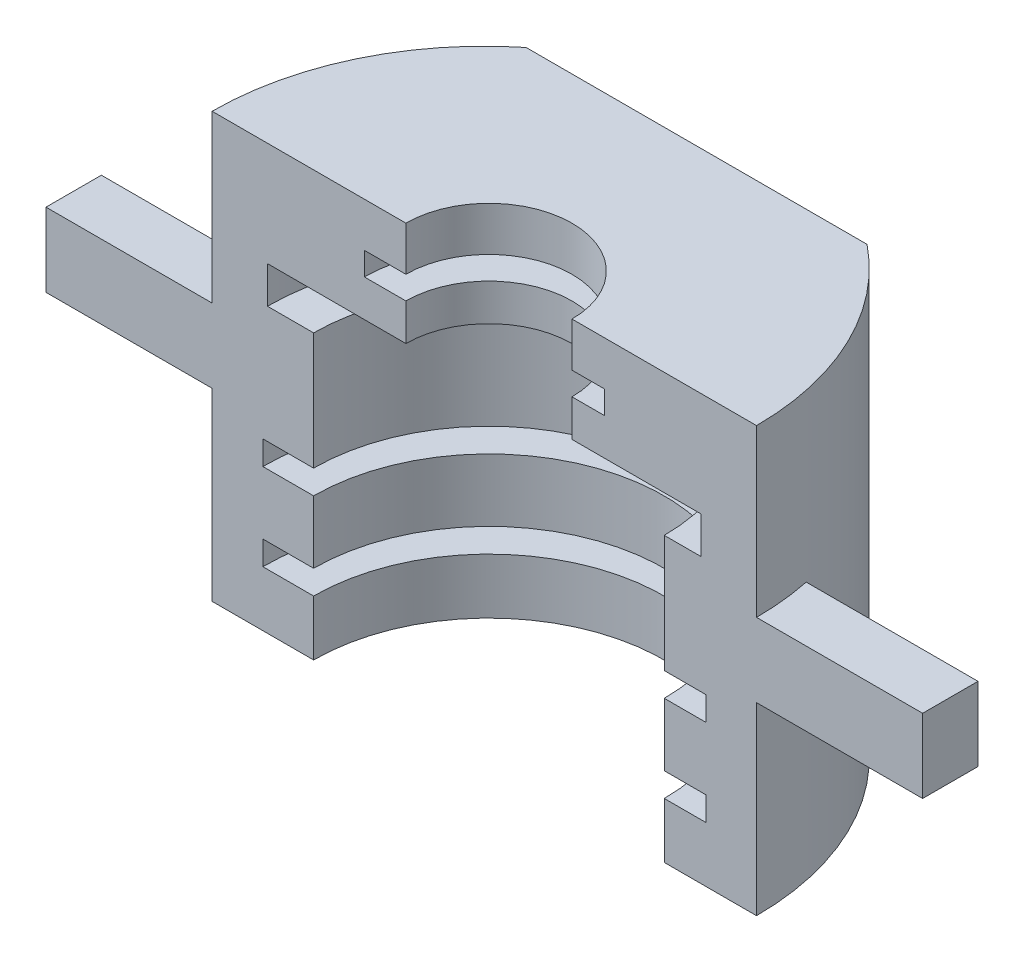
from build123d import *

# Parameters (mm, degrees)
REVOLUCI_N1_ANGLE       = 180
CORTAR_EXTRUIR1_DEPTH   = 17
CORTAR_EXTRUIR2_START   = -5.65
CORTAR_EXTRUIR2_DEPTH   = 5.65
CORTAR_EXTRUIR3_START   = -23
CROQUIS4_W              = 20.036929734
CROQUIS4_H              = 3.3102989
CORTAR_EXTRUIR3_DEPTH   = 23
CROQUIS5_W              = 1
CROQUIS5_H              = 4
CORTAR_EXTRUIR4_DEPTH   = 3
CROQUIS6_W              = 10
CROQUIS6_H              = 4
SALIENTE_EXTRUIR1_DEPTH = 3


with BuildPart() as part:
    # Croquis1 → Revolución1 (revolve)
    with BuildSketch(Plane.XY):
        Polygon((-91.628819856, 0), (-106.128819856, 0), (-106.128819856, 23), (-91.378819856, 23), (-91.378819856, 20.6), (-97.878819856, 20.6), (-97.878819856, 19.35), (-91.378819856, 19.35), (-91.378819856, 17.35), (-103.128819856, 17.35), (-103.128819856, 15.35), (-91.628819856, 15.35), (-91.628819856, 9.003019764), (-103.378819856, 9.003019764), (-103.378819856, 7.703019764), (-91.628819856, 7.703019764), (-91.628819856, 4.303019764), (-103.378819856, 4.303019764), (-103.378819856, 3.003019764), (-91.628819856, 3.003019764), align=None)
    revolve(axis=Axis((-91.378819856, 17.35, 0), (0, -1, 0)), revolution_arc=REVOLUCI_N1_ANGLE)

    # Croquis2 → Cortar-Extruir1 (cut)
    with BuildSketch(Plane.XZ):
        with BuildLine():
            Line((-100.628819856, 0), (-81.628819856, 0))
            ThreePointArc((-81.628819856, 0), (-91.128819856, -9.5), (-100.628819856, 0))
        make_face()
    extrude(amount=-CORTAR_EXTRUIR1_DEPTH, mode=Mode.SUBTRACT)

    # Croquis3 → Cortar-Extruir2 (cut)
    with BuildSketch(Plane(origin=(0, 23, 0), x_dir=(1, 0, 0), z_dir=(0, 1, 0)).offset(CORTAR_EXTRUIR2_START)):
        with BuildLine():
            Line((-86.628819856, 0), (-95.628819856, 0))
            ThreePointArc((-95.628819856, 0), (-91.128819856, 4.5), (-86.628819856, 0))
        make_face()
    extrude(amount=CORTAR_EXTRUIR2_DEPTH, mode=Mode.SUBTRACT)

    # Croquis4 → Cortar-Extruir3 (cut)
    with BuildSketch(Plane.XZ.offset(CORTAR_EXTRUIR3_START)):
        with Locations((-91.493585316, -13.15514945)):
            Rectangle(CROQUIS4_W, CROQUIS4_H)
    extrude(amount=CORTAR_EXTRUIR3_DEPTH, mode=Mode.SUBTRACT)

    # Croquis5 → Cortar-Extruir4 (cut)
    with BuildSketch(Plane.XY):
        with Locations((-105.628819856, 12)):
            Rectangle(CROQUIS5_W, CROQUIS5_H)
        with Locations((-77.128819856, 12)):
            Rectangle(CROQUIS5_W, CROQUIS5_H)
    extrude(amount=-CORTAR_EXTRUIR4_DEPTH, mode=Mode.SUBTRACT)

    # Croquis6 → Saliente-Extruir1 (add)
    with BuildSketch(Plane.XY):
        with Locations((-110.128819856, 12)):
            Rectangle(CROQUIS6_W, CROQUIS6_H)
        with Locations((-72.628819856, 12)):
            Rectangle(CROQUIS6_W, CROQUIS6_H)
    extrude(amount=-SALIENTE_EXTRUIR1_DEPTH)


solid = part.part
